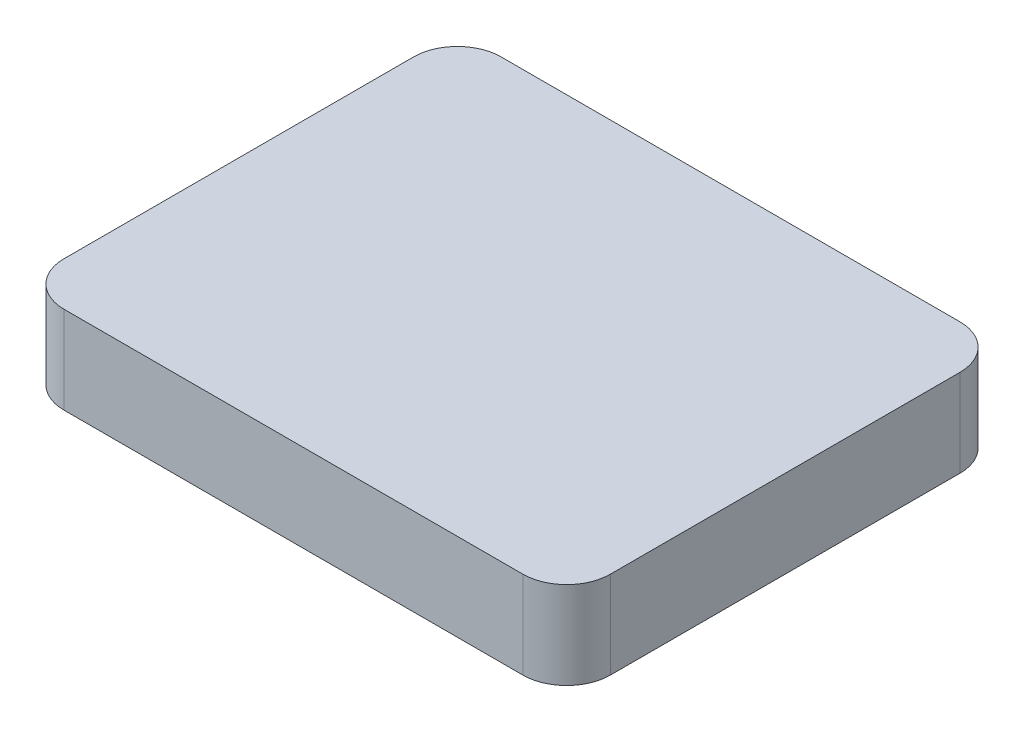
from build123d import *

# Parameters (mm, degrees)
BOSS_EXTRUDE2_DEPTH = 40


with BuildPart() as part:
    # Sketch3 → Boss-Extrude2 (new body)
    with BuildSketch(Plane(origin=(0, 0, 0), x_dir=(1, 0, 0), z_dir=(0, 1, 0))):
        with BuildLine():
            Line((-105, 100), (105, 100))
            ThreePointArc((105, 100), (119.142135624, 94.142135624), (125, 80))
            Line((125, 80), (125, -80))
            ThreePointArc((125, -80), (119.142135624, -94.142135624), (105, -100))
            Line((105, -100), (-105, -100))
            ThreePointArc((-105, -100), (-119.142135624, -94.142135624), (-125, -80))
            Line((-125, -80), (-125, 80))
            ThreePointArc((-125, 80), (-119.142135624, 94.142135624), (-105, 100))
        make_face()
    extrude(amount=BOSS_EXTRUDE2_DEPTH)


solid = part.part
